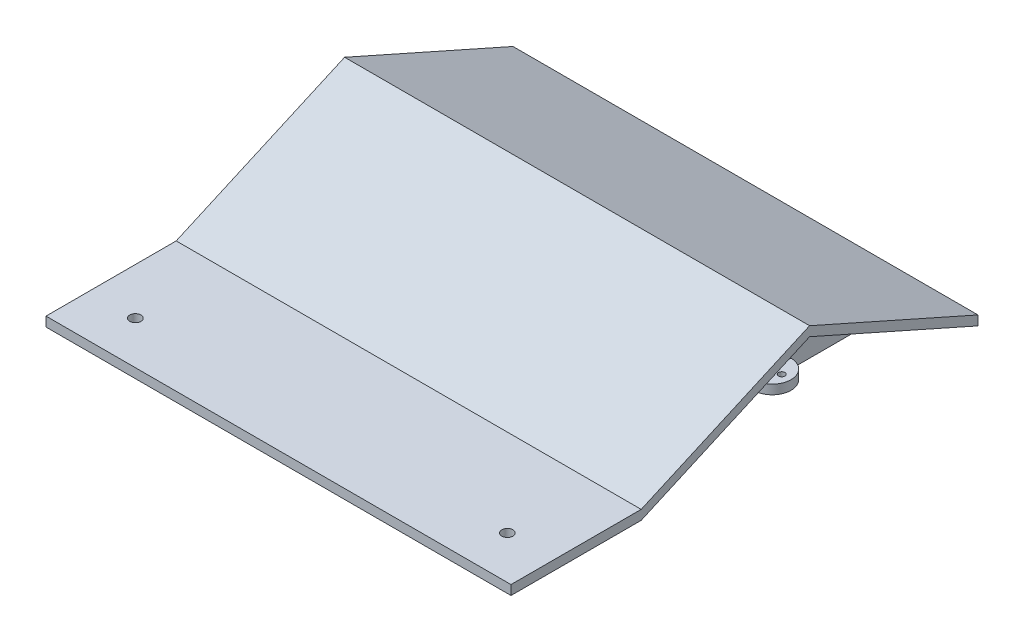
from build123d import *

# Parameters (mm, degrees)
BOSS_EXTRUDE1_DEPTH = 250
BOSS_EXTRUDE2_DEPTH = 25
CUT_EXTRUDE1_DEPTH  = 20
BOSS_EXTRUDE3_DEPTH = 25
CUT_EXTRUDE2_DEPTH  = 20
BOSS_EXTRUDE4_DEPTH = 5
BOSS_EXTRUDE5_DEPTH = 5
SKETCH8_R           = 1.5
CUT_EXTRUDE3_DEPTH  = 10
SKETCH9_W           = 70
SKETCH9_H           = 5.120472302
BOSS_EXTRUDE7_DEPTH = 250
SKETCH11_R          = 3
CUT_EXTRUDE4_DEPTH  = 90


with BuildPart() as part:
    # Sketch1 → Boss-Extrude1 (new body)
    with BuildSketch(Plane(origin=(0, 0, 0), x_dir=(0, 0, -1), z_dir=(1, 0, 0))):
        Polygon((-23.04212536, -5.120472302), (67.5, 35.120472302), (158.04212536, -5.120472302), (158.04212536, -10.240944604), (135, 0), (67.5, 30), (0, 0), (-23.04212536, -10.240944604), align=None)
    extrude(amount=-BOSS_EXTRUDE1_DEPTH)

    # Sketch2 → Boss-Extrude2 (add)
    with BuildSketch(Plane(origin=(0, 0, 0), x_dir=(0, 0, -1), z_dir=(1, 0, 0))):
        Polygon((0, 0), (135, 0), (67.5, 30), align=None)
    extrude(amount=-BOSS_EXTRUDE2_DEPTH)

    # Sketch3 → Cut-Extrude1 (cut)
    with BuildSketch(Plane(origin=(0, 0, 0), x_dir=(0, 0, -1), z_dir=(1, 0, 0))):
        Polygon((0, 0), (135, 0), (67.5, 30), align=None)
    extrude(amount=-CUT_EXTRUDE1_DEPTH, mode=Mode.SUBTRACT)

    # Sketch4 → Boss-Extrude3 (add)
    with BuildSketch(Plane.ZY.offset(250)):
        Polygon((-135, 0), (0, 0), (-67.5, 30), align=None)
    extrude(amount=-BOSS_EXTRUDE3_DEPTH)

    # Sketch5 → Cut-Extrude2 (cut)
    with BuildSketch(Plane.ZY.offset(250)):
        Polygon((-135, 0), (0, 0), (-67.5, 29.582678365), align=None)
    extrude(amount=-CUT_EXTRUDE2_DEPTH, mode=Mode.SUBTRACT)

    # Sketch6 → Boss-Extrude4 (add)
    with BuildSketch(Plane(origin=(0, 0, 0), x_dir=(-1, 0, 0), z_dir=(0, -1, 0))):
        with BuildLine():
            ThreePointArc((233.3, 67.5), (235, 69.2), (236.7, 67.5))
            Line((236.7, 67.5), (240, 67.5))
            ThreePointArc((240, 67.5), (237.071067812, 74.571067812), (230, 77.5))
            Line((230, 77.5), (230, 67.5))
            Line((230, 67.5), (233.3, 67.5))
        make_face()
        with BuildLine():
            Line((240, 67.5), (236.7, 67.5))
            ThreePointArc((236.7, 67.5), (235, 65.8), (233.3, 67.5))
            Line((233.3, 67.5), (230, 67.5))
            Line((230, 67.5), (230, 57.5))
            ThreePointArc((230, 57.5), (237.071067812, 60.428932188), (240, 67.5))
        make_face()
        with BuildLine():
            Line((225, 58.839745962), (225, 76.160254038))
            ThreePointArc((225, 76.160254038), (220, 67.5), (225, 58.839745962))
        make_face()
        with BuildLine():
            Line((230, 67.5), (230, 77.5))
            ThreePointArc((230, 77.5), (227.411809549, 77.159258263), (225, 76.160254038))
            Line((225, 76.160254038), (225, 58.839745962))
            ThreePointArc((225, 58.839745962), (227.411809549, 57.840741737), (230, 57.5))
            Line((230, 57.5), (230, 67.5))
        make_face()
    extrude(amount=-BOSS_EXTRUDE4_DEPTH)

    # Sketch7 → Boss-Extrude5 (add)
    with BuildSketch(Plane(origin=(0, 0, 0), x_dir=(-1, 0, 0), z_dir=(0, -1, 0))):
        with BuildLine():
            Line((20, 57.5), (20, 67.5))
            Line((20, 67.5), (16.7, 67.5))
            ThreePointArc((16.7, 67.5), (15, 65.8), (13.3, 67.5))
            Line((13.3, 67.5), (10, 67.5))
            ThreePointArc((10, 67.5), (12.928932188, 60.428932188), (20, 57.5))
        make_face()
        with BuildLine():
            Line((16.7, 67.5), (20, 67.5))
            Line((20, 67.5), (20, 77.5))
            ThreePointArc((20, 77.5), (12.928932188, 74.571067812), (10, 67.5))
            Line((10, 67.5), (13.3, 67.5))
            ThreePointArc((13.3, 67.5), (15, 69.2), (16.7, 67.5))
        make_face()
        with BuildLine():
            Line((20, 77.5), (20, 67.5))
            Line((20, 67.5), (20, 57.5))
            ThreePointArc((20, 57.5), (22.588190451, 57.840741737), (25, 58.839745962))
            Line((25, 58.839745962), (25, 76.160254038))
            ThreePointArc((25, 76.160254038), (22.588190451, 77.159258263), (20, 77.5))
        make_face()
        with BuildLine():
            ThreePointArc((30, 67.5), (28.660254038, 72.5), (25, 76.160254038))
            Line((25, 76.160254038), (25, 58.839745962))
            ThreePointArc((25, 58.839745962), (28.660254038, 62.5), (30, 67.5))
        make_face()
    extrude(amount=-BOSS_EXTRUDE5_DEPTH)

    # Sketch8 → Cut-Extrude3 (cut)
    with BuildSketch(Plane.ZY.offset(230)):
        with Locations((-67.5, 25)):
            Circle(SKETCH8_R)
    extrude(amount=-CUT_EXTRUDE3_DEPTH, mode=Mode.SUBTRACT)

    # Sketch9 → Boss-Extrude7 (add)
    with BuildSketch(Plane.ZY.offset(250)):
        with Locations((58.04212536, -7.680708453)):
            Rectangle(SKETCH9_W, SKETCH9_H)
    extrude(amount=-BOSS_EXTRUDE7_DEPTH)

    # Sketch11 → Cut-Extrude4 (cut)
    with BuildSketch(Plane(origin=(0, -5.120472302, 0), x_dir=(1, 0, 0), z_dir=(0, 1, 0))):
        with Locations(Location((-225, -70, 0), (0, 0, 270))):
            Circle(SKETCH11_R)
        with Locations(Location((-25, -70, 0), (0, 0, 270))):
            Circle(SKETCH11_R)
    extrude(amount=-CUT_EXTRUDE4_DEPTH, mode=Mode.SUBTRACT)


solid = part.part
